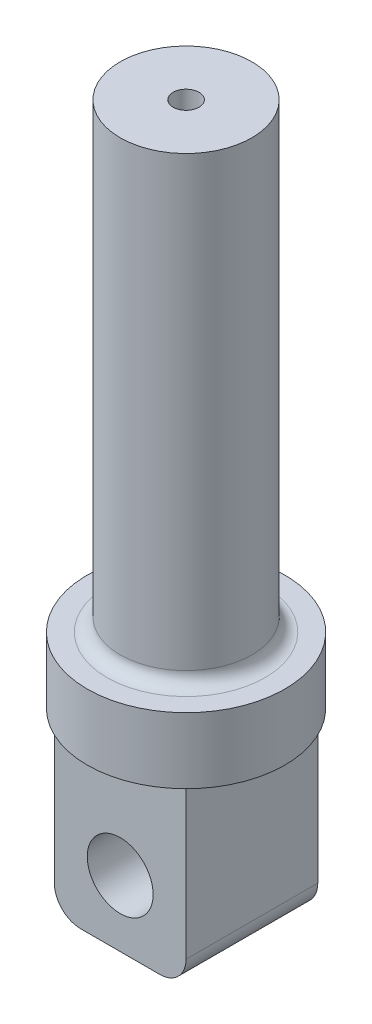
from build123d import *

# Parameters (mm, degrees)
BOSS_EXTRUDE1_DEPTH       = 34.31697226
SKETCH4_R                 = 19.05
BOSS_EXTRUDE2_DEPTH       = 12.7
SKETCH6_R                 = 12.7
BOSS_EXTRUDE3_DEPTH       = 88.9
SKETCH7_R                 = 6.35
CUT_EXTRUDE1_DEPTH        = 141.870111622
FILLET1_R                 = 5.08
FILLET2_R                 = 2.54
M6X1_0_TAPPED_HOLE1_D     = 5
M6X1_0_TAPPED_HOLE1_DEPTH = 41.148
M6X1_0_TAPPED_HOLE1_TIP   = 1.502151548


with BuildPart() as part:
    # Sketch3 → Boss-Extrude1 (new body)
    with BuildSketch(Plane(origin=(0, 0, 0), x_dir=(1, 0, 0), z_dir=(0, 1, 0))):
        Polygon((12.7, 0), (12.7, 12.7), (0, 12.7), (-12.7, 12.7), (-12.7, 0), (-12.7, -12.7), (0, -12.7), (12.7, -12.7), align=None)
    extrude(amount=BOSS_EXTRUDE1_DEPTH)

    # Sketch4 → Boss-Extrude2 (add)
    with BuildSketch(Plane(origin=(0, 34.31697226, 0), x_dir=(1, 0, 0), z_dir=(0, 1, 0))):
        with Locations(Location((0, 0, 0), (0, 0, 270))):
            Circle(SKETCH4_R)
    extrude(amount=BOSS_EXTRUDE2_DEPTH)

    # Sketch6 → Boss-Extrude3 (add)
    with BuildSketch(Plane(origin=(0, 47.01697226, 0), x_dir=(1, 0, 0), z_dir=(0, 1, 0))):
        with Locations(Location((0, 0, 0), (0, 0, 270))):
            Circle(SKETCH6_R)
    extrude(amount=BOSS_EXTRUDE3_DEPTH)

    # Sketch7 → Cut-Extrude1 (cut, through all)
    with BuildSketch(Plane.XY.offset(12.7)):
        with Locations((0, 12.7)):
            Circle(SKETCH7_R)
    extrude(amount=-CUT_EXTRUDE1_DEPTH, mode=Mode.SUBTRACT)

    # Fillet1
    fillet1_edges = [part.edges().sort_by_distance(p)[0] for p in [
        (12.7, 0, 0),
        (-12.7, 0, 0),
    ]]
    fillet(fillet1_edges, radius=FILLET1_R)

    # Fillet2
    fillet2_edges = [part.edges().sort_by_distance(p)[0] for p in [
        (0, 47.01697226, -12.7),
    ]]
    fillet(fillet2_edges, radius=FILLET2_R)

    # M6x1.0 Tapped Hole1
    with Locations(Plane(origin=(0, 135.91697226, 0), x_dir=(1, 0, 0), z_dir=(0, 1, 0))):
        with Locations((0, 0)):
            Hole(M6X1_0_TAPPED_HOLE1_D / 2, depth=M6X1_0_TAPPED_HOLE1_DEPTH)
            with Locations((0, 0, -(M6X1_0_TAPPED_HOLE1_DEPTH + M6X1_0_TAPPED_HOLE1_TIP / 2))):  # 118° drill point
                Cone(0, M6X1_0_TAPPED_HOLE1_D / 2, M6X1_0_TAPPED_HOLE1_TIP, mode=Mode.SUBTRACT)


solid = part.part
